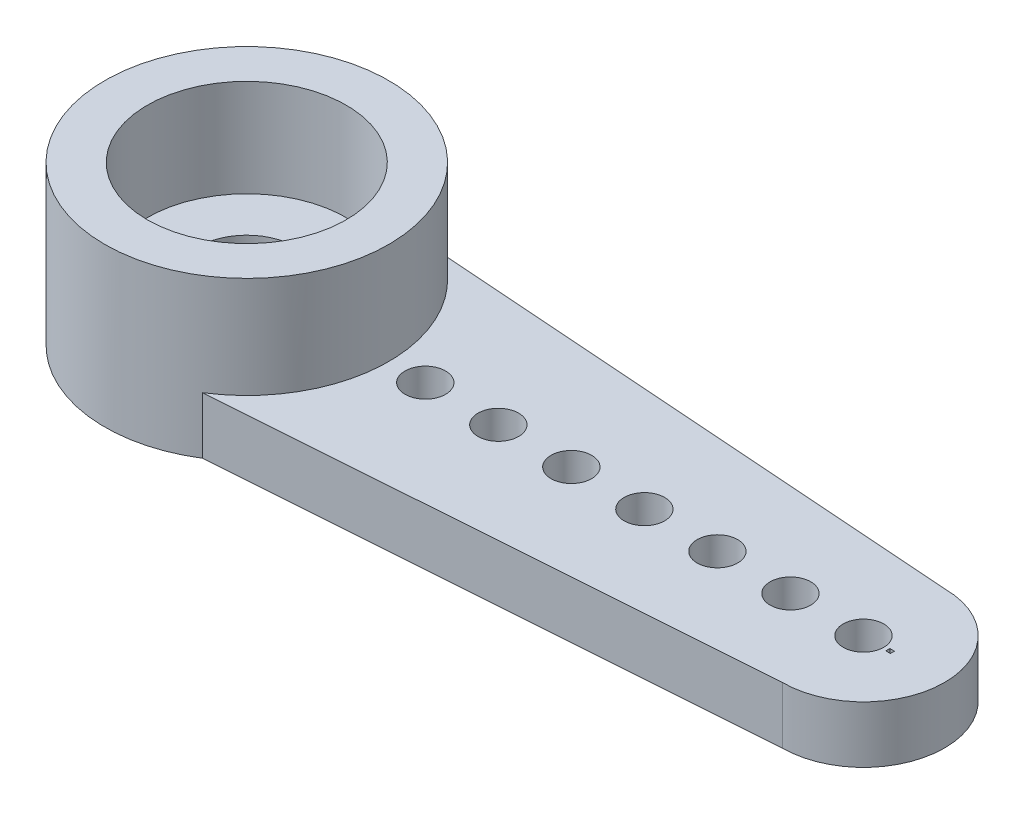
from build123d import *

# Parameters (mm, degrees)
SKETCH1_R           = 0.5
BOSS_EXTRUDE1_DEPTH = 1.4
SKETCH2_R           = 2.35
CUT_EXTRUDE1_DEPTH  = 1
SKETCH3_R           = 3.5
SKETCH3_R_2         = 2.45
BOSS_EXTRUDE2_DEPTH = 2.5
SKETCH4_R           = 1.2
CUT_EXTRUDE2_DEPTH  = 20.282440198
SKETCH5_R           = 2.45
SKETCH5_R_2         = 1.2
BOSS_EXTRUDE3_DEPTH = 0.1
SKETCH6_W           = 35.735260114
SKETCH6_H           = 17.672039004
CUT_EXTRUDE4_DEPTH  = 20.513392837
CUT_EXTRUDE5_DEPTH  = 18.980545042
SKETCH8_W           = 0.114102852
SKETCH8_H           = 0.1
CUT_EXTRUDE6_DEPTH  = 0.1


with BuildPart() as part:
    # Sketch1 → Boss-Extrude1 (new body)
    with BuildSketch(Plane(origin=(0, 0, 0), x_dir=(1, 0, 0), z_dir=(0, 1, 0))):
        with BuildLine():
            Line((-15.2, 2), (-2, 2.95))
            Line((-2, 2.95), (-2, 6.35))
            ThreePointArc((-2, 6.35), (0, 8.35), (2, 6.35))
            Line((2, 6.35), (2, 3.5))
            Line((2, 3.5), (15.2, 2))
            ThreePointArc((15.2, 2), (17.2, 0), (15.2, -2))
            Line((15.2, -2), (2, -3.5))
            Line((2, -3.5), (2, -6.35))
            ThreePointArc((2, -6.35), (0, -8.35), (-2, -6.35))
            Line((-2, -6.35), (-2, -2.95))
            Line((-2, -2.95), (-15.2, -2))
            ThreePointArc((-15.2, -2), (-17.2, 0), (-15.2, 2))
        make_face()
        with Locations(Location((0, 6.35, 0), (0, 0, 270))):
            Circle(SKETCH1_R, mode=Mode.SUBTRACT)
        with Locations(Location((0, 4.55, 0), (0, 0, 270))):
            Circle(SKETCH1_R, mode=Mode.SUBTRACT)
        with Locations(Location((0, -4.55, 0), (0, 0, 90))):
            Circle(SKETCH1_R, mode=Mode.SUBTRACT)
        with Locations(Location((0, -6.35, 0), (0, 0, 90))):
            Circle(SKETCH1_R, mode=Mode.SUBTRACT)
        with Locations(Location((-15.2, 0, 0), (0, 0, 270))):
            Circle(SKETCH1_R, mode=Mode.SUBTRACT)
        with Locations(Location((15.2, 0, 0), (0, 0, 270))):
            Circle(SKETCH1_R, mode=Mode.SUBTRACT)
        with Locations(Location((-13.4, 0, 0), (0, 0, 270))):
            Circle(SKETCH1_R, mode=Mode.SUBTRACT)
        with Locations(Location((-11.6, 0, 0), (0, 0, 270))):
            Circle(SKETCH1_R, mode=Mode.SUBTRACT)
        with Locations(Location((-9.8, 0, 0), (0, 0, 270))):
            Circle(SKETCH1_R, mode=Mode.SUBTRACT)
        with Locations(Location((-8, 0, 0), (0, 0, 270))):
            Circle(SKETCH1_R, mode=Mode.SUBTRACT)
        with Locations(Location((-6.2, 0, 0), (0, 0, 270))):
            Circle(SKETCH1_R, mode=Mode.SUBTRACT)
        with Locations(Location((-4.4, 0, 0), (0, 0, 270))):
            Circle(SKETCH1_R, mode=Mode.SUBTRACT)
        with Locations(Location((13.4, 0, 0), (0, 0, 270))):
            Circle(SKETCH1_R, mode=Mode.SUBTRACT)
        with Locations(Location((11.6, 0, 0), (0, 0, 270))):
            Circle(SKETCH1_R, mode=Mode.SUBTRACT)
        with Locations(Location((9.8, 0, 0), (0, 0, 270))):
            Circle(SKETCH1_R, mode=Mode.SUBTRACT)
        with Locations(Location((8, 0, 0), (0, 0, 270))):
            Circle(SKETCH1_R, mode=Mode.SUBTRACT)
        with Locations(Location((6.2, 0, 0), (0, 0, 270))):
            Circle(SKETCH1_R, mode=Mode.SUBTRACT)
        with Locations(Location((4.4, 0, 0), (0, 0, 270))):
            Circle(SKETCH1_R, mode=Mode.SUBTRACT)
    extrude(amount=BOSS_EXTRUDE1_DEPTH)

    # Sketch2 → Cut-Extrude1 (cut)
    with BuildSketch(Plane.XZ):
        with Locations(Location((0, 0, 0), (0, 0, 270))):
            Circle(SKETCH2_R)
    extrude(amount=-CUT_EXTRUDE1_DEPTH, mode=Mode.SUBTRACT)

    # Sketch3 → Boss-Extrude2 (add)
    with BuildSketch(Plane(origin=(0, 1.4, 0), x_dir=(1, 0, 0), z_dir=(0, 1, 0))):
        with Locations(Location((0, 0, 0), (0, 0, 270))):
            Circle(SKETCH3_R)
        with Locations(Location((0, 0, 0), (0, 0, 270))):
            Circle(SKETCH3_R_2, mode=Mode.SUBTRACT)
    extrude(amount=BOSS_EXTRUDE2_DEPTH)

    # Sketch4 → Cut-Extrude2 (cut, through all)
    with BuildSketch(Plane(origin=(0, 1.4, 0), x_dir=(1, 0, 0), z_dir=(0, 1, 0))):
        with Locations(Location((0, 0, 0), (0, 0, 270))):
            Circle(SKETCH4_R)
    extrude(amount=-CUT_EXTRUDE2_DEPTH, mode=Mode.SUBTRACT)

    # Sketch5 → Boss-Extrude3 (add)
    with BuildSketch(Plane(origin=(0, 1.4, 0), x_dir=(1, 0, 0), z_dir=(0, 1, 0))):
        with Locations(Location((0, 0, 0), (0, 0, 270))):
            Circle(SKETCH5_R)
        with Locations(Location((0, 0, 0), (0, 0, 270))):
            Circle(SKETCH5_R_2, mode=Mode.SUBTRACT)
    extrude(amount=BOSS_EXTRUDE3_DEPTH)

    # Sketch6 → Cut-Extrude4 (cut, through all)
    with BuildSketch(Plane.XZ):
        Rectangle(SKETCH6_W, SKETCH6_H)
        with BuildLine():
            Line((-1.868584713, -2.959457918), (-15.2, -2))
            ThreePointArc((-15.2, -2), (-17.2, 0), (-15.2, 2))
            Line((-15.2, 2), (-1.868584713, 2.959457918))
            ThreePointArc((-1.868584713, 2.959457918), (0, 3.5), (1.868584713, 2.959457918))
            Line((1.868584713, 2.959457918), (15.2, 2))
            ThreePointArc((15.2, 2), (17.2, 0), (15.2, -2))
            Line((15.2, -2), (1.868584713, -2.959457918))
            ThreePointArc((1.868584713, -2.959457918), (0, -3.5), (-1.868584713, -2.959457918))
        make_face(mode=Mode.SUBTRACT)
    extrude(amount=-CUT_EXTRUDE4_DEPTH, mode=Mode.SUBTRACT)

    # Sketch7 → Cut-Extrude5 (cut, through all)
    with BuildSketch(Plane.XZ):
        with BuildLine():
            Line((0, 3.5), (-17.731768104, 3.5))
            Line((-17.731768104, 3.5), (-17.731768104, -3.5))
            Line((-17.731768104, -3.5), (0, -3.5))
            ThreePointArc((0, -3.5), (-3.5, 0), (0, 3.5))
        make_face()
    extrude(amount=-CUT_EXTRUDE5_DEPTH, mode=Mode.SUBTRACT)

    # Sketch8 → Cut-Extrude6 (cut)
    with BuildSketch(Plane(origin=(0, 1.4, 0), x_dir=(1, 0, 0), z_dir=(0, 1, 0))):
        with Locations((15.857051426, 0)):
            Rectangle(SKETCH8_W, SKETCH8_H)
    extrude(amount=-CUT_EXTRUDE6_DEPTH, mode=Mode.SUBTRACT)


solid = part.part
